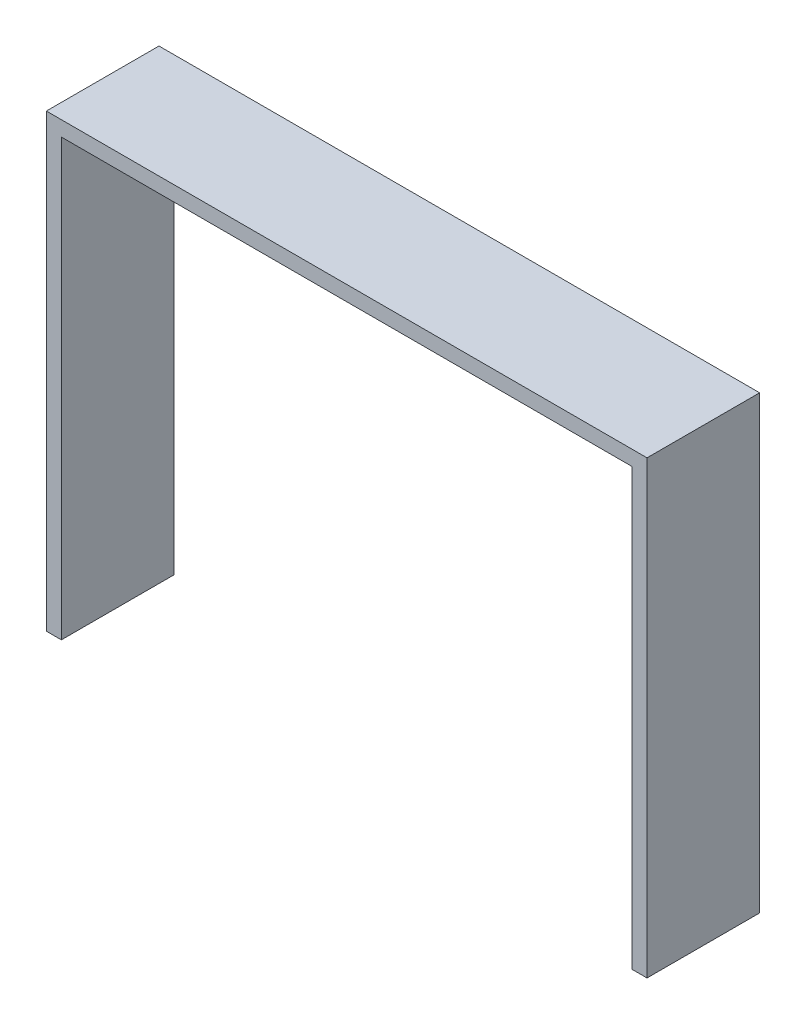
from build123d import *

# Parameters (mm, degrees)
BOSS_EXTRUDE1_DEPTH = 15
SCALE1_SCALE        = 0.7


with BuildPart() as part:
    # Sketch2 → Boss-Extrude1 (new body)
    with BuildSketch(Plane(origin=(0, 0, 0), x_dir=(0, 1, 0), z_dir=(0, 0, 1))):
        Polygon((-30, -38), (-30, -40), (30, -40), (30, 40), (-30, 40), (-30, 38), (28, 38), (28, -38), align=None)
    extrude(amount=-BOSS_EXTRUDE1_DEPTH)


with BuildPart() as part_1:
    # Scale1: scaled about (0, 11.244897959, -7.5)
    add(part.part.scale(SCALE1_SCALE).moved(Location((0, 3.373469388, -2.25))))


solid = part_1.part
